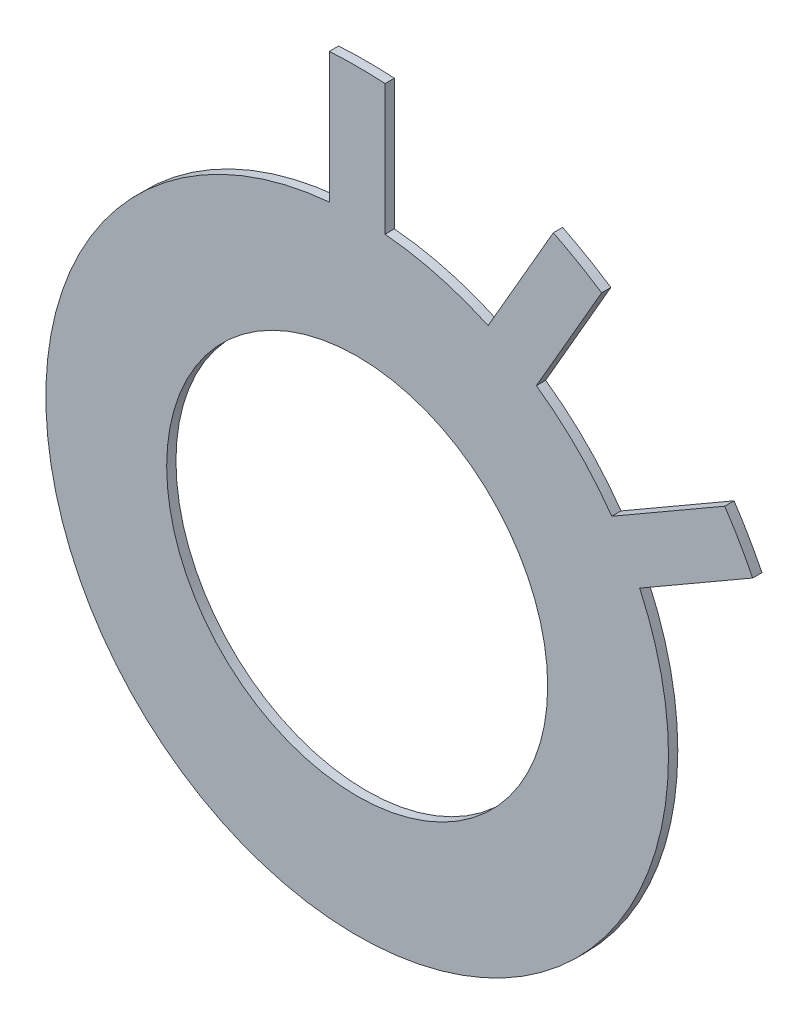
from build123d import *

# Parameters (mm, degrees)
SKETCH_1_R      = 20.5
EXTRUDE_1_DEPTH = 1


with BuildPart() as part:
    # 草图1 → 拉伸1 (new body)
    with BuildSketch(Plane.XY):
        with BuildLine():
            Line((14.084624409, 30.395285083), (21.104508036, 42.554080187))
            ThreePointArc((21.104508036, 42.554080187), (23.75, 41.13620668), (26.300660459, 39.554080187))
            Line((26.300660459, 39.554080187), (19.280776832, 27.395285083))
            ThreePointArc((19.280776832, 27.395285083), (23.68807717, 23.68807717), (27.395285083, 19.280776832))
            Line((27.395285083, 19.280776832), (39.554080187, 26.300660459))
            ThreePointArc((39.554080187, 26.300660459), (41.13620668, 23.75), (42.554080187, 21.104508036))
            Line((42.554080187, 21.104508036), (30.395285083, 14.084624409))
            ThreePointArc((30.395285083, 14.084624409), (-16.75, -29.011851027), (-3, 33.365401241))
            Line((-3, 33.365401241), (-3, 47.405168495))
            ThreePointArc((-3, 47.405168495), (0, 47.5), (3, 47.405168495))
            Line((3, 47.405168495), (3, 33.365401241))
            ThreePointArc((3, 33.365401241), (8.670438011, 32.358515181), (14.084624409, 30.395285083))
        make_face()
        Circle(SKETCH_1_R, mode=Mode.SUBTRACT)
    extrude(amount=EXTRUDE_1_DEPTH)


solid = part.part
